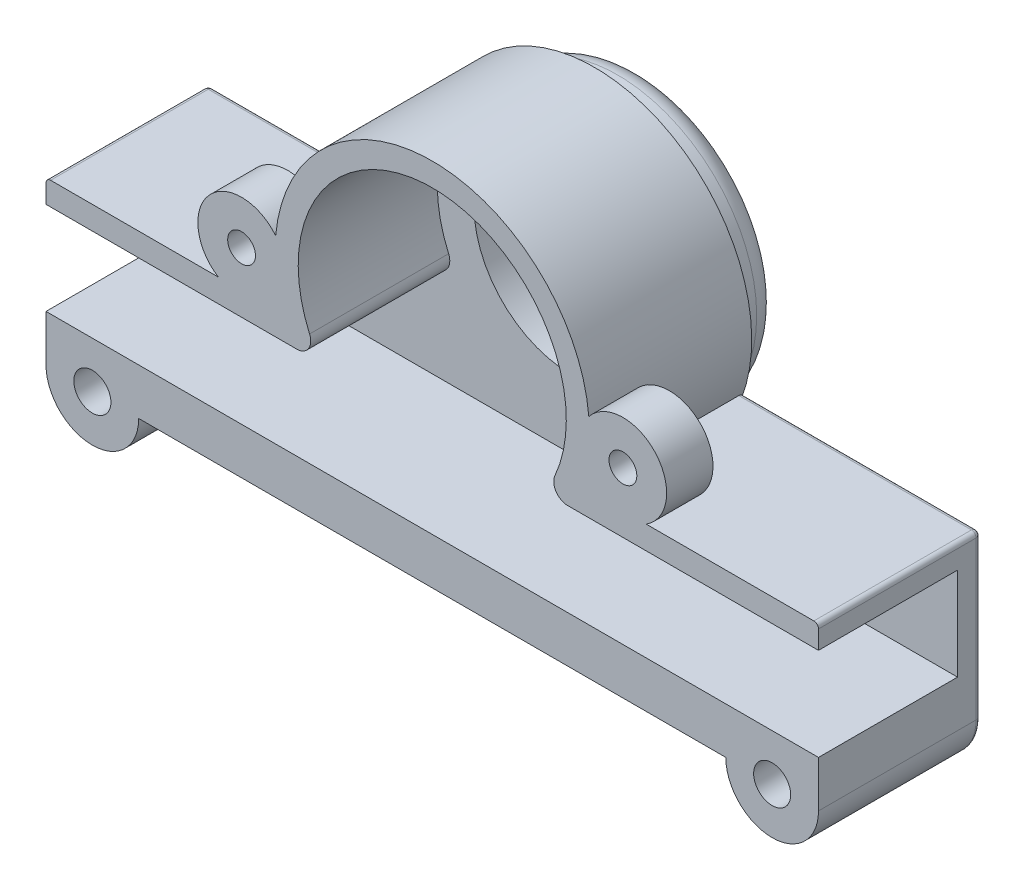
from build123d import *
from build123d.topology import SkipClean

# Parameters (mm, degrees)
SKETCH1_R           = 4
SKETCH1_R_2         = 15
BOSS_EXTRUDE2_DEPTH = 5
SKETCH2_R           = 4
BOSS_EXTRUDE3_DEPTH = 30
BOSS_EXTRUDE4_START = 10
SKETCH4_R           = 30
SKETCH4_R_2         = 15
BOSS_EXTRUDE4_DEPTH = 10
BOSS_EXTRUDE6_START = -10
SKETCH7_R           = 3
BOSS_EXTRUDE6_DEPTH = 10
FILLET1_R           = 5
CUT_EXTRUDE2_START  = -10
SKETCH5_R           = 21
SKETCH5_R_2         = 15
CUT_EXTRUDE2_DEPTH  = 10
SKETCH8_R           = 18
CUT_EXTRUDE3_DEPTH  = 2
FILLET2_R           = 1
FILLET3_R           = 3


with BuildPart() as part:
    # Sketch1 → Boss-Extrude2 (new body)
    with BuildSketch(Plane.XY):
        with BuildLine():
            Line((-83.333333333, -10.859226218), (-83.333333333, -35.859226218))
            Line((-83.333333333, -35.859226218), (-83.333333333, -45.859226218))
            ThreePointArc((-83.333333333, -45.859226218), (-73.333333333, -55.859226218), (-63.333333333, -45.859226218))
            Line((-63.333333333, -45.859226218), (0, -45.859226218))
            Line((0, -45.859226218), (63.333333333, -45.859226218))
            ThreePointArc((63.333333333, -45.859226218), (73.333333333, -55.859226218), (83.333333333, -45.859226218))
            Line((83.333333333, -45.859226218), (83.333333333, -35.859226218))
            Line((83.333333333, -35.859226218), (83.333333333, -10.859226218))
            Line((83.333333333, -10.859226218), (32.135632545, -10.859226218))
            ThreePointArc((32.135632545, -10.859226218), (0, 33.920814748), (-32.135632545, -10.859226218))
            Line((-32.135632545, -10.859226218), (-83.333333333, -10.859226218))
        make_face()
        with Locations((-73.333333333, -45.859226218)):
            Circle(SKETCH1_R, mode=Mode.SUBTRACT)
        with Locations((73.333333333, -45.859226218)):
            Circle(SKETCH1_R, mode=Mode.SUBTRACT)
        Circle(SKETCH1_R_2, mode=Mode.SUBTRACT)
    extrude(amount=BOSS_EXTRUDE2_DEPTH)

    # Sketch2 → Boss-Extrude3 (add)
    # profile 1 of 2: a face of its own
    with BuildSketch(Plane.XY.offset(5)):
        with BuildLine():
            Line((83.333333333, -35.859226218), (-83.333333333, -35.859226218))
            Line((-83.333333333, -35.859226218), (-83.333333333, -45.859226218))
            ThreePointArc((-83.333333333, -45.859226218), (-73.333333333, -55.859226218), (-63.333333333, -45.859226218))
            Line((-63.333333333, -45.859226218), (63.333333333, -45.859226218))
            ThreePointArc((63.333333333, -45.859226218), (73.333333333, -55.859226218), (83.333333333, -45.859226218))
            Line((83.333333333, -45.859226218), (83.333333333, -35.859226218))
        make_face()
        with Locations((-73.333333333, -45.859226218)):
            Circle(SKETCH2_R, mode=Mode.SUBTRACT)
        with Locations((73.333333333, -45.859226218)):
            Circle(SKETCH2_R, mode=Mode.SUBTRACT)
    # profile 2 of 2: a face of its own
    with BuildSketch(Plane.XY.offset(5)):
        with BuildLine():
            Line((-83.333333333, -10.859226218), (-83.333333333, -15.859226218))
            Line((-83.333333333, -15.859226218), (-24.184674268, -15.859226218))
            ThreePointArc((-24.184674268, -15.859226218), (0, 28.920814748), (24.184674268, -15.859226218))
            Line((24.184674268, -15.859226218), (83.333333333, -15.859226218))
            Line((83.333333333, -15.859226218), (83.333333333, -10.859226218))
            Line((83.333333333, -10.859226218), (32.135632545, -10.859226218))
            ThreePointArc((32.135632545, -10.859226218), (0, 33.920814748), (-32.135632545, -10.859226218))
            Line((-32.135632545, -10.859226218), (-83.333333333, -10.859226218))
        make_face()
    extrude(amount=BOSS_EXTRUDE3_DEPTH)

    # Sketch4 → Boss-Extrude4 (add)
    with SkipClean():  # the faces are left unmerged after this step: merging them gives an invalid solid
        with BuildSketch(Plane(origin=(0, 0, 0), x_dir=(-1, 0, 0), z_dir=(0, 0, -1)).offset(BOSS_EXTRUDE4_START)):
            with Locations(Location((0, 0, 0), (0, 0, 180))):
                Circle(SKETCH4_R)
            Circle(SKETCH4_R_2, mode=Mode.SUBTRACT)
        extrude(amount=-BOSS_EXTRUDE4_DEPTH)

    # Sketch7 → Boss-Extrude6 (add)
    # profile 1 of 2: a face of its own
    with SkipClean():  # the faces are left unmerged after this step: merging them gives an invalid solid
        with BuildSketch(Plane.XY.offset(35).offset(BOSS_EXTRUDE6_START)):
            with BuildLine():
                Line((-46.135632545, -10.859226218), (-32.135632545, -10.859226218))
                ThreePointArc((-32.135632545, -10.859226218), (-33.685378506, -3.989604998), (-33.783237398, 3.051973795))
                ThreePointArc((-33.783237398, 3.051973795), (-48.189979587, 3.404653395), (-46.135632545, -10.859226218))
            make_face()
            with Locations((-41.135632545, -2.859226218)):
                Circle(SKETCH7_R, mode=Mode.SUBTRACT)
        # profile 2 of 2: a face of its own
        with BuildSketch(Plane.XY.offset(35).offset(BOSS_EXTRUDE6_START)):
            with BuildLine():
                Line((46.135632545, -10.859226218), (32.135632545, -10.859226218))
                ThreePointArc((32.135632545, -10.859226218), (33.685378506, -3.989604998), (33.783237398, 3.051973795))
                ThreePointArc((33.783237398, 3.051973795), (48.189979587, 3.404653395), (46.135632545, -10.859226218))
            make_face()
            with Locations((41.135632545, -2.859226218)):
                Circle(SKETCH7_R, mode=Mode.SUBTRACT)
        extrude(amount=BOSS_EXTRUDE6_DEPTH)

    # Fillet1
    fillet1_edges = [part.edges().sort_by_distance(p)[0] for p in [
        (-30, 0, -10),
    ]]
    fillet(fillet1_edges, radius=FILLET1_R)

    # Sketch5 → Cut-Extrude2 (cut)
    with BuildSketch(Plane.XY.offset(5).offset(CUT_EXTRUDE2_START)):
        Circle(SKETCH5_R)
        with Locations(Location((0, 0, 0), (0, 0, 180))):
            Circle(SKETCH5_R_2, mode=Mode.SUBTRACT)
    extrude(amount=CUT_EXTRUDE2_DEPTH, mode=Mode.SUBTRACT)

    # Sketch8 → Cut-Extrude3 (cut)
    with BuildSketch(Plane.XY.offset(-5)):
        Circle(SKETCH8_R)
    extrude(amount=-CUT_EXTRUDE3_DEPTH, mode=Mode.SUBTRACT)

    # Fillet2
    fillet2_edges = [part.edges().sort_by_distance(p)[0] for p in [
        (-73.333333333, -55.859226218, 0),
        (-83.333333333, -28.359226218, 0),
        (-57.734482939, -10.859226218, 0),
        (57.734482939, -10.859226218, 0),
        (83.333333333, -28.359226218, 0),
        (73.333333333, -55.859226218, 0),
        (0, -45.859226218, 0),
        (-83.333333333, -10.859226218, 17.5),
        (83.333333333, -10.859226218, 17.5),
    ]]
    fillet(fillet2_edges, radius=FILLET2_R)

    # Fillet3
    fillet3_edges = [part.edges().sort_by_distance(p)[0] for p in [
        (-24.184674268, -15.859226218, 20),
        (24.184674268, -15.859226218, 20),
    ]]
    fillet(fillet3_edges, radius=FILLET3_R)


solid = part.part
